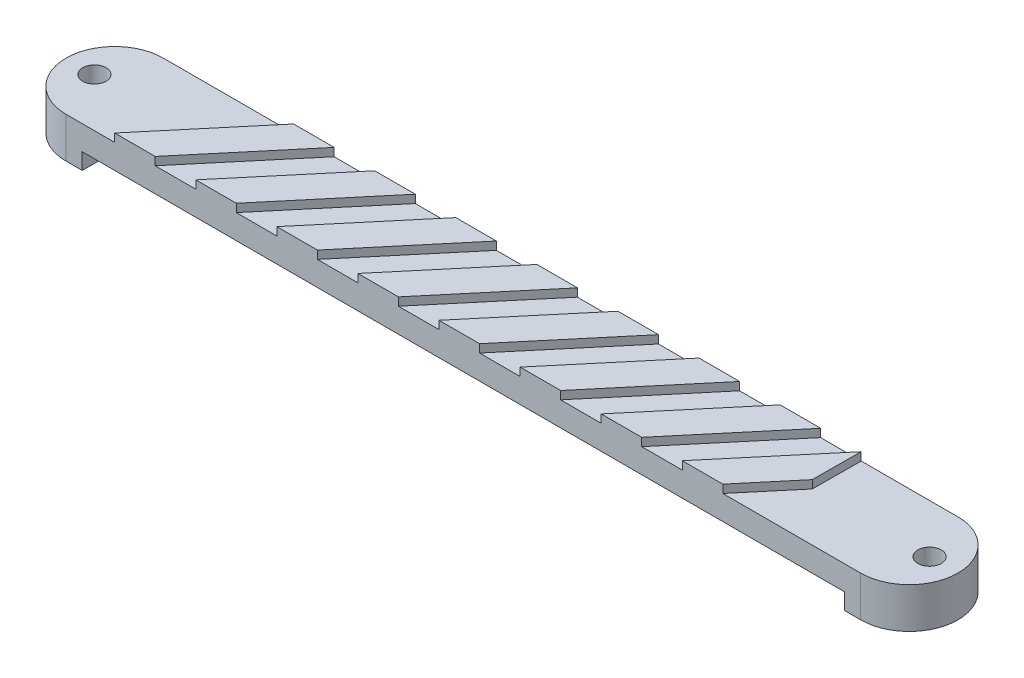
from build123d import *

# Parameters (mm, degrees)
SKETCH1_R           = 1.45
BOSS_EXTRUDE1_DEPTH = 3
BOSS_EXTRUDE2_START = 2
BOSS_EXTRUDE2_DEPTH = 2
BOSS_EXTRUDE3_DEPTH = 1


with BuildPart() as part:
    # Sketch1 → Boss-Extrude1 (new body)
    with BuildSketch(Plane(origin=(0, 0, 0), x_dir=(1, 0, 0), z_dir=(0, 1, 0))):
        with BuildLine():
            Line((-49, 6), (49, 6))
            ThreePointArc((49, 6), (55, 0), (49, -6))
            Line((49, -6), (-49, -6))
            ThreePointArc((-49, -6), (-55, 0), (-49, 6))
        make_face()
        with Locations(Location((-51.5, 0, 0), (0, 0, 270))):
            Circle(SKETCH1_R, mode=Mode.SUBTRACT)
        with Locations(Location((51.5, 0, 0), (0, 0, 270))):
            Circle(SKETCH1_R, mode=Mode.SUBTRACT)
    extrude(amount=BOSS_EXTRUDE1_DEPTH)

    # Sketch2 → Boss-Extrude2 (add)
    # profile 1 of 2: a face of its own
    with BuildSketch(Plane.XZ.offset(BOSS_EXTRUDE2_START)):
        with BuildLine():
            Line((49, 6), (47, 6))
            Line((47, 6), (47, -6))
            Line((47, -6), (49, -6))
            ThreePointArc((49, -6), (55, 0), (49, 6))
        make_face()
        Polygon((54.675426481, 0), (53.08771324, -2.75), (49.91228676, -2.75), (48.324573519, 0), (49.91228676, 2.75), (53.08771324, 2.75), align=None, mode=Mode.SUBTRACT)
    # profile 2 of 2: a face of its own
    with BuildSketch(Plane.XZ.offset(BOSS_EXTRUDE2_START)):
        with BuildLine():
            Line((-47, -6), (-47, 6))
            Line((-47, 6), (-49, 6))
            ThreePointArc((-49, 6), (-55, 0), (-49, -6))
            Line((-49, -6), (-47, -6))
        make_face()
        Polygon((-48.324573519, 0), (-49.91228676, -2.75), (-53.08771324, -2.75), (-54.675426481, 0), (-53.08771324, 2.75), (-49.91228676, 2.75), align=None, mode=Mode.SUBTRACT)
    extrude(amount=-BOSS_EXTRUDE2_DEPTH)

    # Sketch3 → Boss-Extrude3 (add)
    with BuildSketch(Plane(origin=(0, 3, 0), x_dir=(1, 0, 0), z_dir=(0, 1, 0))):
        Polygon((-32.930804426, 6), (-43, -6), (-38, -6), (-27.930804426, 6), align=None)
        Polygon((-17.930804426, 6), (-22.930804426, 6), (-33, -6), (-28, -6), align=None)
        Polygon((-7.930804426, 6), (-12.930804426, 6), (-23, -6), (-18, -6), align=None)
        Polygon((2.069195574, 6), (-2.930804426, 6), (-13, -6), (-8, -6), align=None)
        Polygon((12.069195574, 6), (7.069195574, 6), (-3, -6), (2, -6), align=None)
        Polygon((22.069195574, 6), (17.069195574, 6), (7, -6), (12, -6), align=None)
        Polygon((32.069195574, 6), (27.069195574, 6), (17, -6), (22, -6), align=None)
        Polygon((37.069195574, 6), (27, -6), (32, -6), (37.034597787, 0), align=None)
    extrude(amount=BOSS_EXTRUDE3_DEPTH)


solid = part.part
